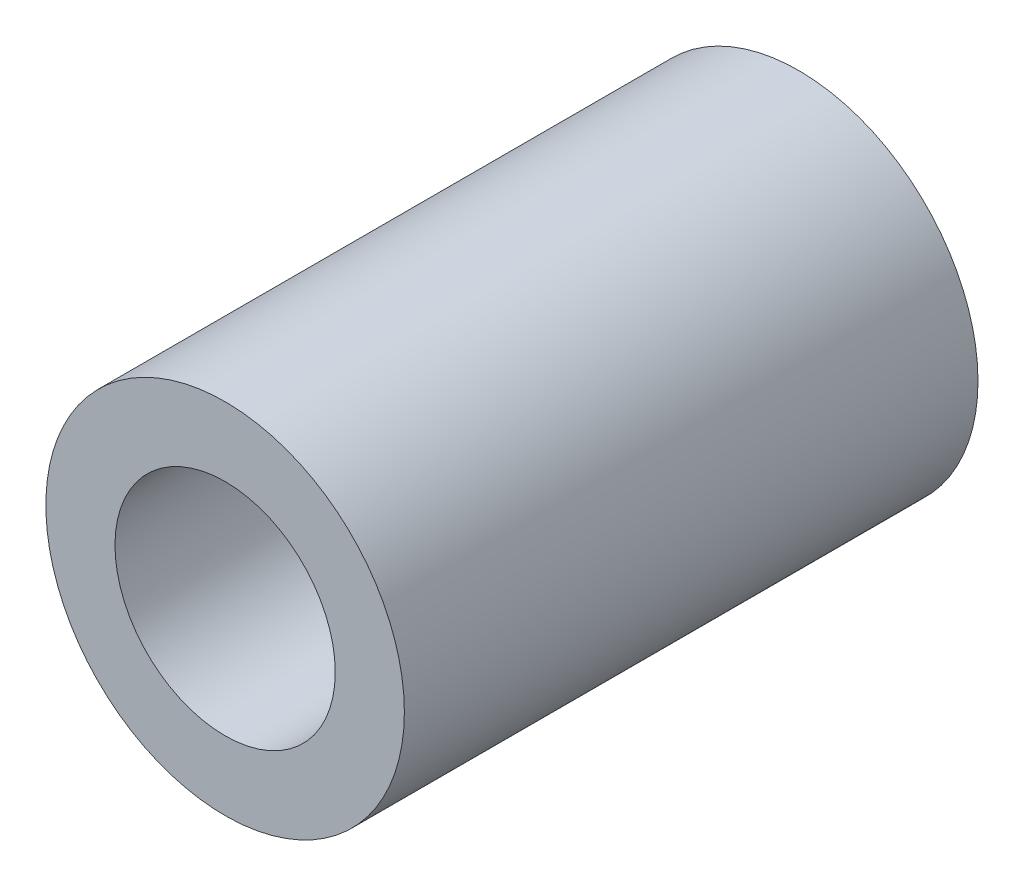
from build123d import *

# Parameters (mm, degrees)
SKETCH1_R      = 3.96875
SKETCH1_R_2    = 2.4384
EXTRUDE1_DEPTH = 6.35


with BuildPart() as part:
    # Sketch1 → Extrude1 (new, symmetric)
    with BuildSketch(Plane.XY):
        Circle(SKETCH1_R)
        Circle(SKETCH1_R_2, mode=Mode.SUBTRACT)
    extrude(amount=EXTRUDE1_DEPTH, both=True)


solid = part.part
